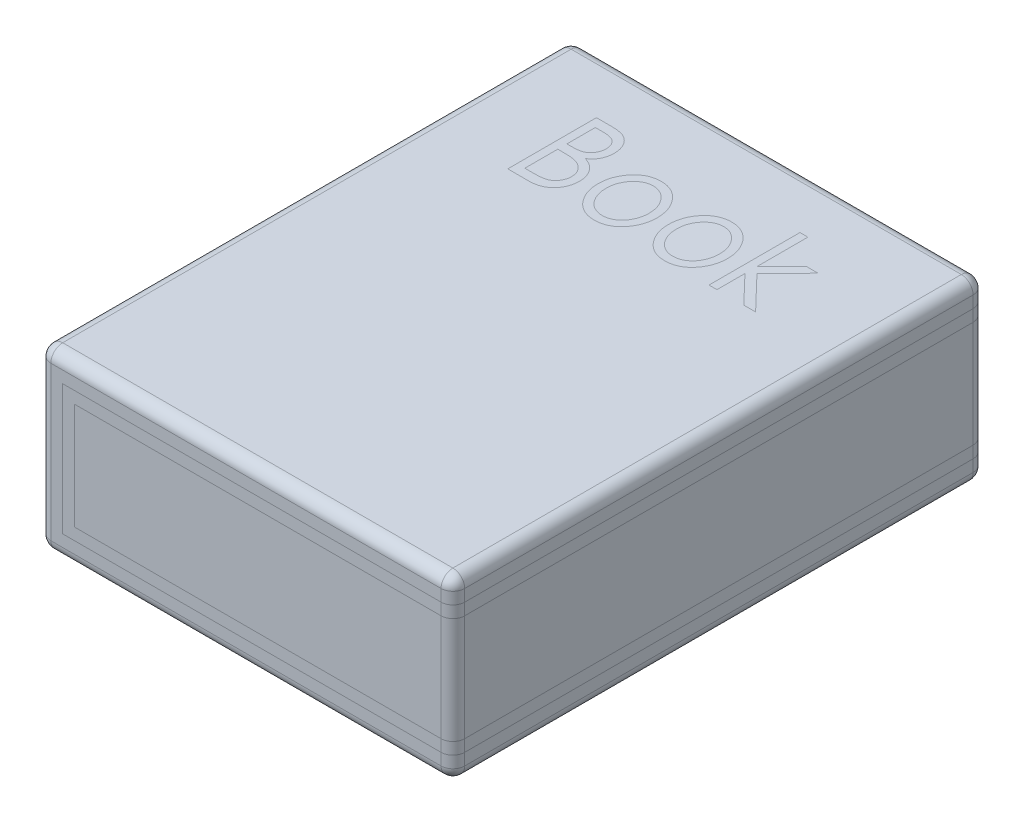
from build123d import *

# Parameters (mm, degrees)
SKETCH1_W         = 7
SKETCH1_H         = 9
BOOK_DEPTH        = 3
SMOOTHING_EDGES_R = 0.2


with BuildPart() as part:
    # Sketch1 → Book (new body)
    with BuildSketch(Plane(origin=(0, 0, 0), x_dir=(1, 0, 0), z_dir=(0, 1, 0))):
        Rectangle(SKETCH1_W, SKETCH1_H)
    extrude(amount=BOOK_DEPTH)

    # Smoothing edges
    smoothing_edges_edges = [part.edges().sort_by_distance(p)[0] for p in [
        (-3.5, 3, 0),
        (0, 3, 4.5),
        (3.5, 1.5, -4.5),
        (3.5, 1.5, -4.5),
        (3.5, 1.5, 4.5),
        (3.5, 1.5, 4.5),
        (3.5, 1.5, 4.5),
        (3.5, 1.5, 4.5),
        (3.5, 1.5, -4.5),
        (3.5, 1.5, -4.5),
        (3.5, 3, 0),
        (0, 0, 4.5),
        (-3.5, 0, 0),
        (0, 0, -4.5),
        (3.5, 0, 0),
        (0, 3, -4.5),
        (3.5, 1.5, 4.5),
        (-3.5, 1.5, 4.5),
        (-3.5, 1.5, -4.5),
        (3.5, 1.5, -4.5),
    ]]
    fillet(smoothing_edges_edges, radius=SMOOTHING_EDGES_R)


solid = part.part
